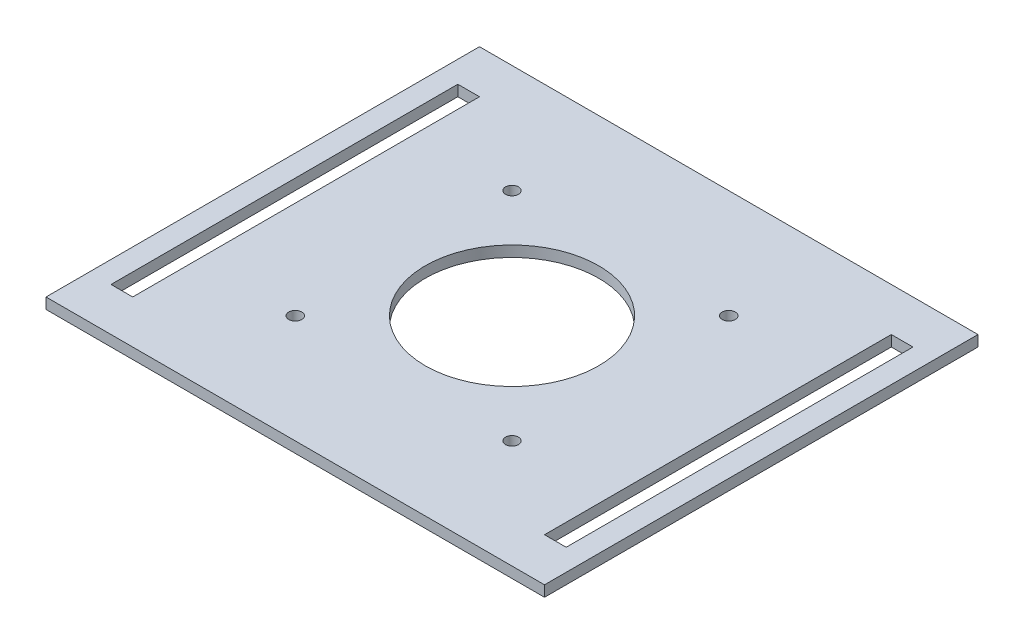
from build123d import *

# Parameters (mm, degrees)
SKETCH1_W           = 230
SKETCH1_H           = 200
SKETCH1_W_2         = 10
SKETCH1_H_2         = 160
BOSS_EXTRUDE1_DEPTH = 5
SKETCH2_R           = 40
SKETCH2_R_2         = 3
CUT_EXTRUDE1_DEPTH  = 5


with BuildPart() as part:
    # Sketch1 → Boss-Extrude1 (new body)
    with BuildSketch(Plane(origin=(0, 0, 0), x_dir=(1, 0, 0), z_dir=(0, 1, 0))):
        Rectangle(SKETCH1_W, SKETCH1_H)
        with Locations((-100, 0)):
            Rectangle(SKETCH1_W_2, SKETCH1_H_2, mode=Mode.SUBTRACT)
        with Locations((100, 0)):
            Rectangle(SKETCH1_W_2, SKETCH1_H_2, mode=Mode.SUBTRACT)
    extrude(amount=BOSS_EXTRUDE1_DEPTH)

    # Sketch2 → Cut-Extrude1 (cut)
    with BuildSketch(Plane(origin=(0, 5, 0), x_dir=(1, 0, 0), z_dir=(0, 1, 0))):
        with Locations(Location((0, 0, 0), (0, 0, 270))):
            Circle(SKETCH2_R)
        with Locations(Location((-50, 50, 0), (0, 0, 270))):
            Circle(SKETCH2_R_2)
        with Locations(Location((50, 50, 0), (0, 0, 270))):
            Circle(SKETCH2_R_2)
        with Locations(Location((50, -50, 0), (0, 0, 270))):
            Circle(SKETCH2_R_2)
        with Locations(Location((-50, -50, 0), (0, 0, 270))):
            Circle(SKETCH2_R_2)
    extrude(amount=-CUT_EXTRUDE1_DEPTH, mode=Mode.SUBTRACT)


solid = part.part
